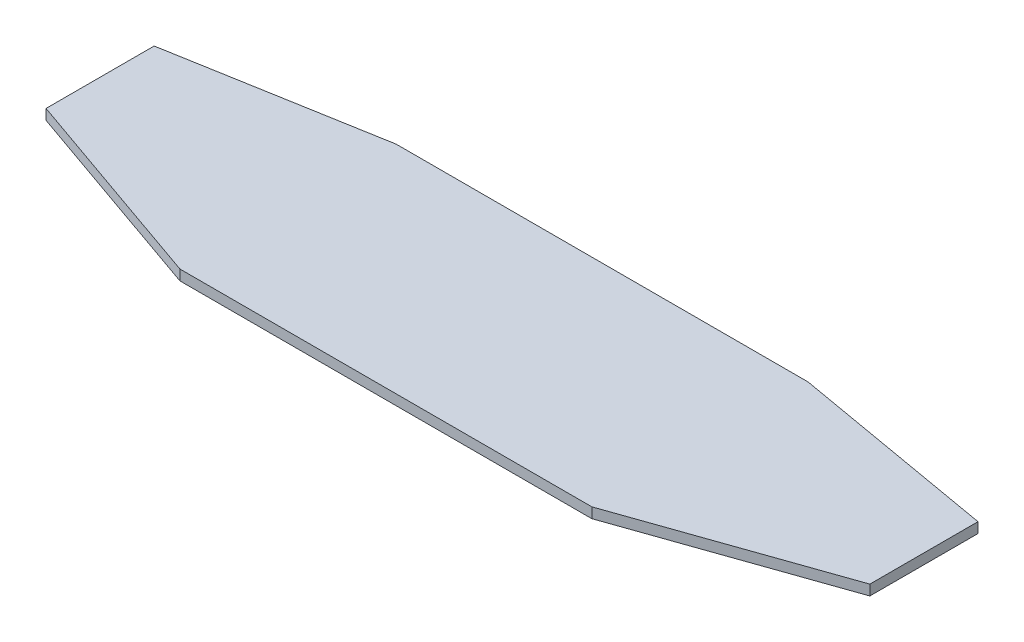
from build123d import *

# Parameters (mm, degrees)
EXTRUDE_1_DEPTH = 10


with BuildPart() as part:
    # 草图1 → 拉伸1 (new body)
    with BuildSketch(Plane(origin=(0, 0, 0), x_dir=(1, 0, 0), z_dir=(0, 1, 0))):
        Polygon((-200, 140), (200, 140), (400, 105), (400, 0), (200, -70), (-200, -70), (-400, 0), (-400, 105), align=None)
    extrude(amount=EXTRUDE_1_DEPTH)


solid = part.part
